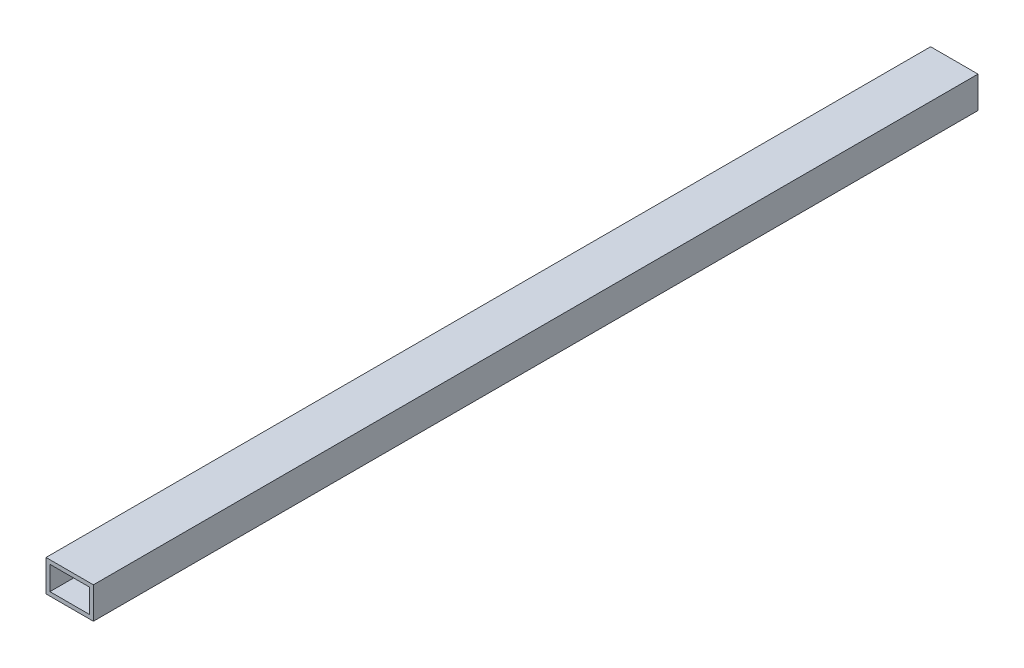
from build123d import *

# Parameters (mm, degrees)
BOSS_EXTRUDE1_DEPTH      = 355.6
BOSS_EXTRUDE1_DEPTH_BACK = 355.6
SKETCH3_W                = 38.1
SKETCH3_H                = 25.4
SKETCH3_W_2              = 31.75
SKETCH3_H_2              = 19.05


with BuildPart() as part:
    # Sketch3 → Boss-Extrude1 (new, two sides: drawn at the far end of the back side and taken through both)
    with BuildSketch(Plane.XY.offset(-BOSS_EXTRUDE1_DEPTH_BACK)):
        Rectangle(SKETCH3_W, SKETCH3_H)
        Rectangle(SKETCH3_W_2, SKETCH3_H_2, mode=Mode.SUBTRACT)
    extrude(amount=BOSS_EXTRUDE1_DEPTH + BOSS_EXTRUDE1_DEPTH_BACK)


solid = part.part
